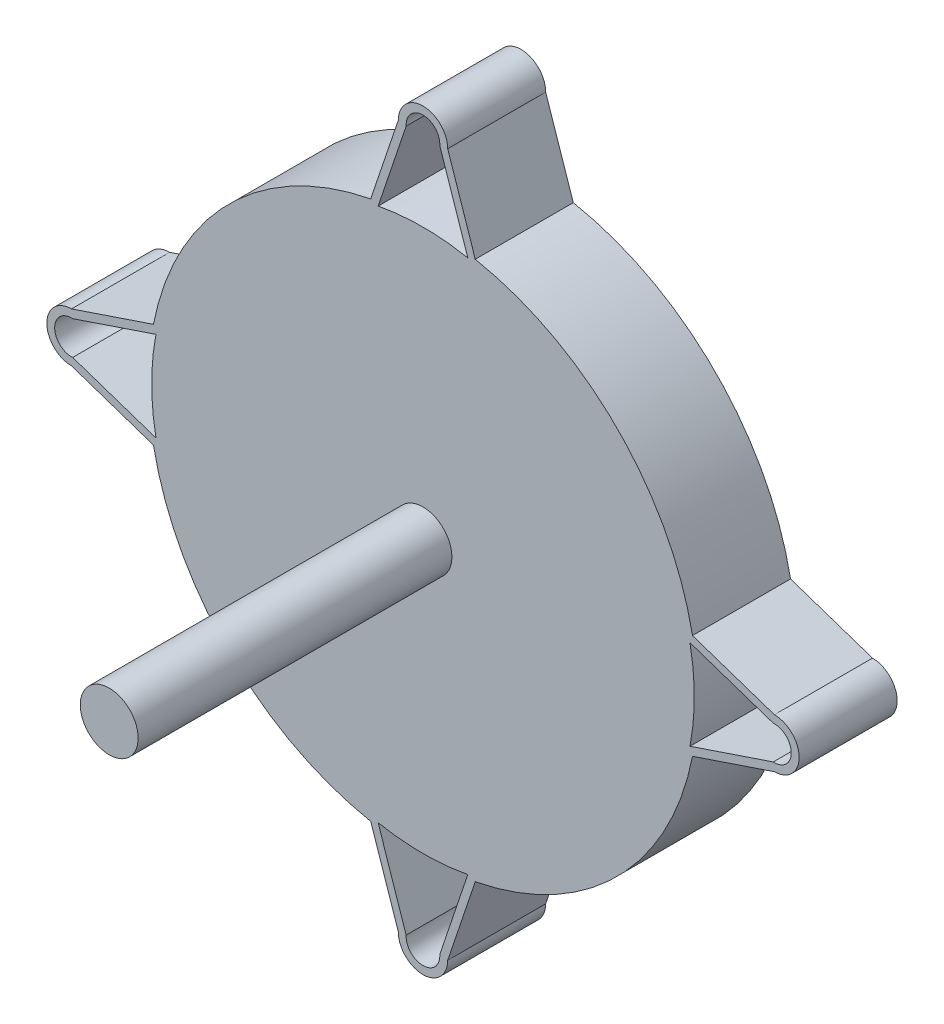
from build123d import *

# Parameters (mm, degrees)
SKETCH1_R           = 70
BOSS_EXTRUDE1_DEPTH = 25
BOSS_EXTRUDE3_DEPTH = 25
CUT_EXTRUDE1_DEPTH  = 23
CUT_EXTRUDE2_REACH  = 122.942
SKETCH6_R           = 2.5
CIRPATTERN2_COUNT   = 4
SKETCH7_R           = 7.375
BOSS_EXTRUDE4_DEPTH = 80


with BuildPart() as part:
    # Sketch1 → Boss-Extrude1 (new body)
    with BuildSketch(Plane.XY):
        Circle(SKETCH1_R)
    extrude(amount=BOSS_EXTRUDE1_DEPTH)

    # Sketch3 → Boss-Extrude3 (add)
    with BuildSketch(Plane.XY):
        with BuildLine():
            Line((13.329299006, 68.719209745), (6.292622314, 89.613315607))
            ThreePointArc((6.292622314, 89.613315607), (0, 95.90593792), (-6.292622314, 89.613315607))
            Line((-6.292622314, 89.613315607), (-13.329299006, 68.719209745))
            ThreePointArc((-13.329299006, 68.719209745), (0, 70), (13.329299006, 68.719209745))
        make_face()
    boss_extrude3 = extrude(amount=BOSS_EXTRUDE3_DEPTH)

    # Sketch5 → Cut-Extrude1 (cut)
    with BuildSketch(Plane.XY.offset(25)):
        with BuildLine():
            Line((11.433900255, 68.080881008), (4.282324573, 89.316158104))
            ThreePointArc((4.282324573, 89.316158104), (0, 93.90593792), (-4.282324573, 89.316158104))
            Line((-4.282324573, 89.316158104), (-11.433900255, 68.080881008))
            ThreePointArc((-11.433900255, 68.080881008), (0, 69.180406265), (11.433900255, 68.080881008))
        make_face()
    cut_extrude1 = extrude(amount=-CUT_EXTRUDE1_DEPTH, mode=Mode.SUBTRACT)

    # Sketch6 → Cut-Extrude2 (cut, up to next)
    with BuildSketch(Plane.XY.offset(2), mode=Mode.PRIVATE) as cut_extrude2_sk1:
        with Locations((0, 89.613315607)):
            Circle(SKETCH6_R)
    cut_extrude2_tool1 = extrude(cut_extrude2_sk1.sketch, amount=-CUT_EXTRUDE2_REACH, mode=Mode.PRIVATE) & part.part
    cut_extrude2 = cut_extrude2_tool1.solids().sort_by_distance((0, 89.613316, 2))[0]
    add(cut_extrude2, mode=Mode.SUBTRACT)

    # CirPattern2: Boss-Extrude3, Cut-Extrude1, Cut-Extrude2 ×4 about axis
    cirpattern2_axis = Axis((0, 0, 0), (0, 0, 1))
    add([boss_extrude3.rotate(cirpattern2_axis, i * 360 / CIRPATTERN2_COUNT) for i in range(1, CIRPATTERN2_COUNT)])
    add([cut_extrude1.rotate(cirpattern2_axis, i * 360 / CIRPATTERN2_COUNT) for i in range(1, CIRPATTERN2_COUNT)], mode=Mode.SUBTRACT)
    add([cut_extrude2.rotate(cirpattern2_axis, i * 360 / CIRPATTERN2_COUNT) for i in range(1, CIRPATTERN2_COUNT)], mode=Mode.SUBTRACT)

    # Sketch7 → Boss-Extrude4 (add)
    with BuildSketch(Plane.XY.offset(25)):
        Circle(SKETCH7_R)
    extrude(amount=BOSS_EXTRUDE4_DEPTH)


solid = part.part
